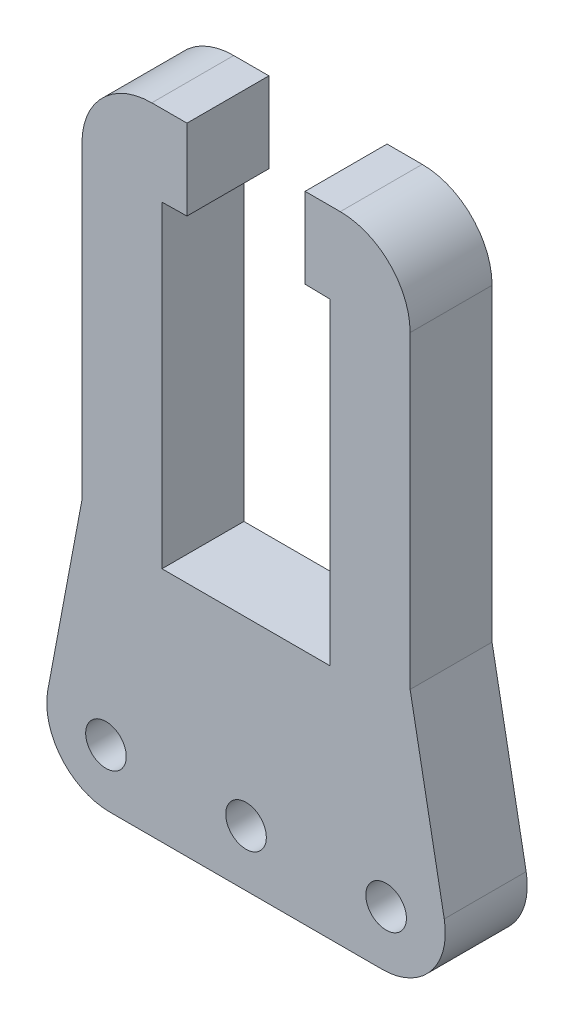
from build123d import *

# Parameters (mm, degrees)
MODEL_R             = 1.449999899
MODEL_R_2           = 1.450000076
BOSS_EXTRUDE1_DEPTH = 5.85


with BuildPart() as part:
    # Model → Boss-Extrude1 (new body)
    with BuildSketch(Plane.XY):
        with BuildLine():
            Line((508.267115634, 556.488649767), (505.831367634, 543.517354767))
            ThreePointArc((505.831367634, 543.517354767), (506.791253617, 539.812058859), (510.255750143, 538.184833401))
            Line((510.255750143, 538.184833401), (529.708723634, 538.184833401))
            ThreePointArc((529.708723634, 538.184833401), (533.173220159, 539.812058859), (534.133106143, 543.517354767))
            Line((534.133106143, 543.517354767), (531.697358143, 556.488649767))
            Line((531.697358143, 556.488649767), (531.697358143, 578.551691787))
            ThreePointArc((531.697358143, 578.551691787), (530.236877746, 582.07760337), (526.710966163, 583.538083767))
            Line((526.710966163, 583.538083767), (524.199056888, 583.538083767))
            Line((524.199056888, 583.538083767), (524.199056888, 577.792158))
            Line((524.199056888, 577.792158), (525.982236888, 577.762664))
            Line((525.982236888, 577.762664), (525.982236888, 555.093173))
            Line((525.982236888, 555.093173), (513.982236888, 555.093173))
            Line((513.982236888, 555.093173), (513.982236888, 577.762664))
            Line((513.982236888, 577.762664), (515.765416888, 577.792158))
            Line((515.765416888, 577.792158), (515.765416888, 583.538083767))
            Line((515.765416888, 583.538083767), (513.253507613, 583.538083767))
            ThreePointArc((513.253507613, 583.538083767), (509.727596031, 582.07760337), (508.267115634, 578.551691787))
            Line((508.267115634, 578.551691787), (508.267115634, 556.488649767))
        make_face()
        with Locations(Location((509.982236888, 542.200965, 0), (0, 0, 180))):
            Circle(MODEL_R, mode=Mode.SUBTRACT)
        with Locations((519.982236888, 542.200965)):
            Circle(MODEL_R_2, mode=Mode.SUBTRACT)
        with Locations((529.982236888, 542.200965)):
            Circle(MODEL_R, mode=Mode.SUBTRACT)
    extrude(amount=BOSS_EXTRUDE1_DEPTH)


solid = part.part
